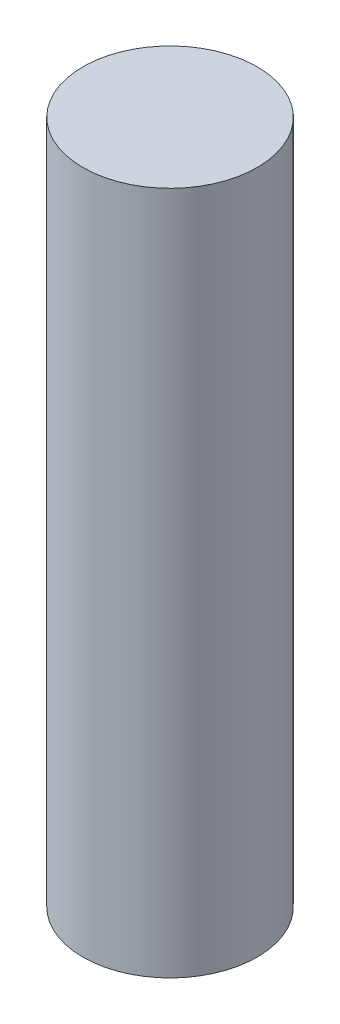
from build123d import *

# Parameters (mm, degrees)
SKETCH_1_R      = 2.55
EXTRUDE_1_DEPTH = 20


with BuildPart() as part:
    # 스케치1 → 보스-돌출1 (new body)
    with BuildSketch(Plane(origin=(0, 0, 0), x_dir=(1, 0, 0), z_dir=(0, 1, 0))):
        with Locations(Location((0, 0, 0), (0, 0, 270))):
            Circle(SKETCH_1_R)
    extrude(amount=EXTRUDE_1_DEPTH)


solid = part.part
